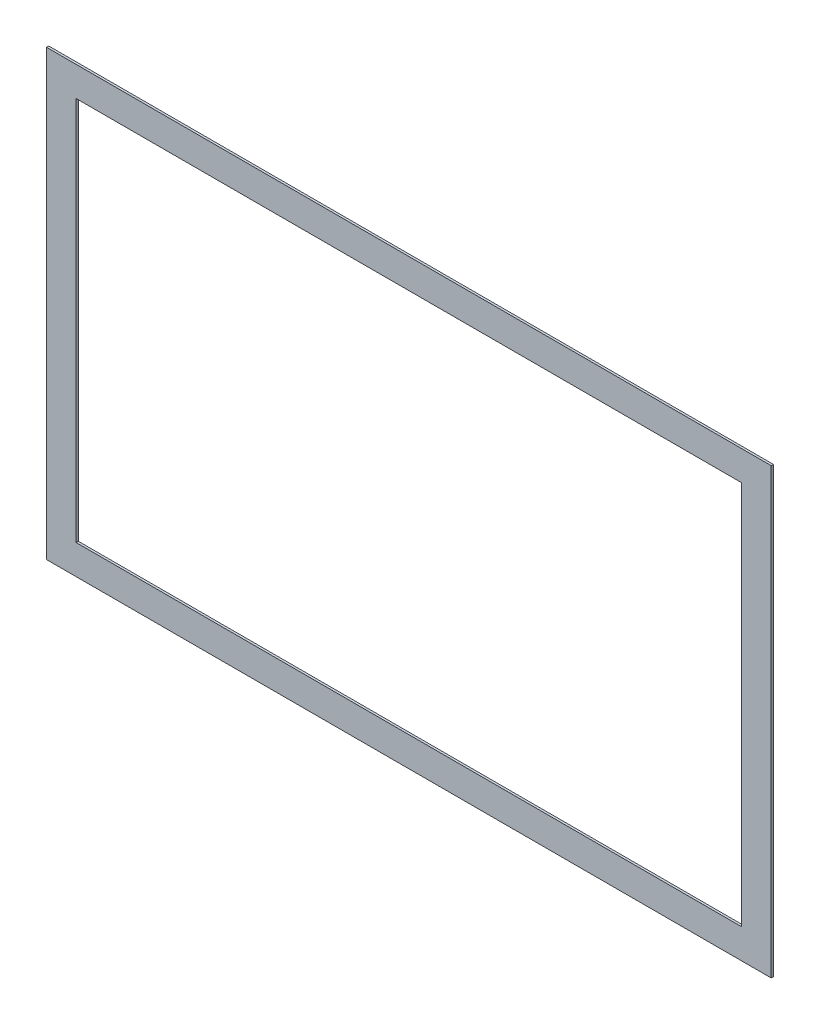
from build123d import *

# Parameters (mm, degrees)
OVEN_PANEL_SPREY_1_START = 38.5
SKETCH1_W                = 490
SKETCH1_H                = 300
OVEN_PANEL_SPREY_1_DEPTH = 1.5
OVEN_PANEL_SPREY_2_START = 37.5
SKETCH2_W                = 450
SKETCH2_H                = 260
OVEN_PANEL_SPREY_2_DEPTH = 3.5


with BuildPart() as part:
    # Sketch1 → OVEN_panel_sprey_1 (new body)
    with BuildSketch(Plane.XY.offset(OVEN_PANEL_SPREY_1_START)):
        with Locations((425, 970)):
            Rectangle(SKETCH1_W, SKETCH1_H)
    extrude(amount=OVEN_PANEL_SPREY_1_DEPTH)

    # Sketch2 → OVEN_panel_sprey_2 (cut)
    with BuildSketch(Plane.XY.offset(OVEN_PANEL_SPREY_2_START)):
        with Locations((425, 970)):
            Rectangle(SKETCH2_W, SKETCH2_H)
    extrude(amount=OVEN_PANEL_SPREY_2_DEPTH, mode=Mode.SUBTRACT)


solid = part.part
